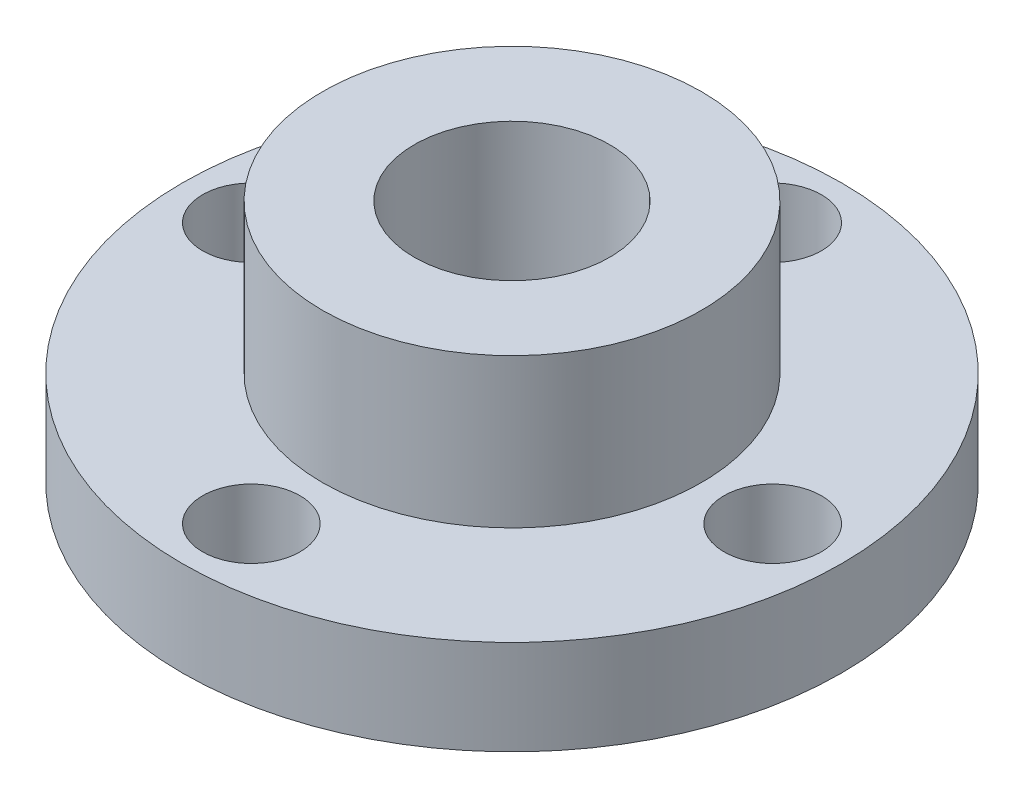
from build123d import *

# Parameters (mm, degrees)
SKETCH1_R          = 22.098
SKETCH1_R_2        = 4.826
MAIN_BODY_DEPTH    = 6.35
SKETCH2_R          = 12.7
SKETCH2_R_2        = 6.5484375
TAP_BOSS_DEPTH     = 10.000000066
SKETCH6_R          = 3.2639
CUT_EXTRUDE1_DEPTH = 33.81224176
CIRPATTERN1_COUNT  = 4


with BuildPart() as part:
    # Sketch1 → main body (new body)
    with BuildSketch(Plane(origin=(0, 0, 0), x_dir=(1, 0, 0), z_dir=(0, 1, 0))):
        with Locations(Location((0, 0, 0), (0, 0, 270))):
            Circle(SKETCH1_R)
        with Locations(Location((0, 0, 0), (0, 0, 270))):
            Circle(SKETCH1_R_2, mode=Mode.SUBTRACT)
    extrude(amount=MAIN_BODY_DEPTH)

    # Sketch2 → tap boss (add)
    with BuildSketch(Plane(origin=(0, 6.35, 0), x_dir=(1, 0, 0), z_dir=(0, 1, 0))):
        with Locations(Location((0, 0, 0), (0, 0, 270))):
            Circle(SKETCH2_R)
        with Locations(Location((0, 0, 0), (0, 0, 270))):
            Circle(SKETCH2_R_2, mode=Mode.SUBTRACT)
    extrude(amount=TAP_BOSS_DEPTH)

    # Sketch6 → Cut-Extrude1 (cut, through all)
    with BuildSketch(Plane(origin=(0, 6.35, 0), x_dir=(1, 0, 0), z_dir=(0, 1, 0))):
        with Locations(Location((-17.472412237, 0, 0), (0, 0, 270))):
            Circle(SKETCH6_R)
    cut_extrude1 = extrude(amount=-CUT_EXTRUDE1_DEPTH, mode=Mode.SUBTRACT)

    # CirPattern1: Cut-Extrude1 ×4 about axis
    cirpattern1_axis = Axis((0, 0, 0), (0, 1, 0))
    for i in range(1, CIRPATTERN1_COUNT):
        add(cut_extrude1.rotate(cirpattern1_axis, i * 360 / CIRPATTERN1_COUNT), mode=Mode.SUBTRACT)


solid = part.part
